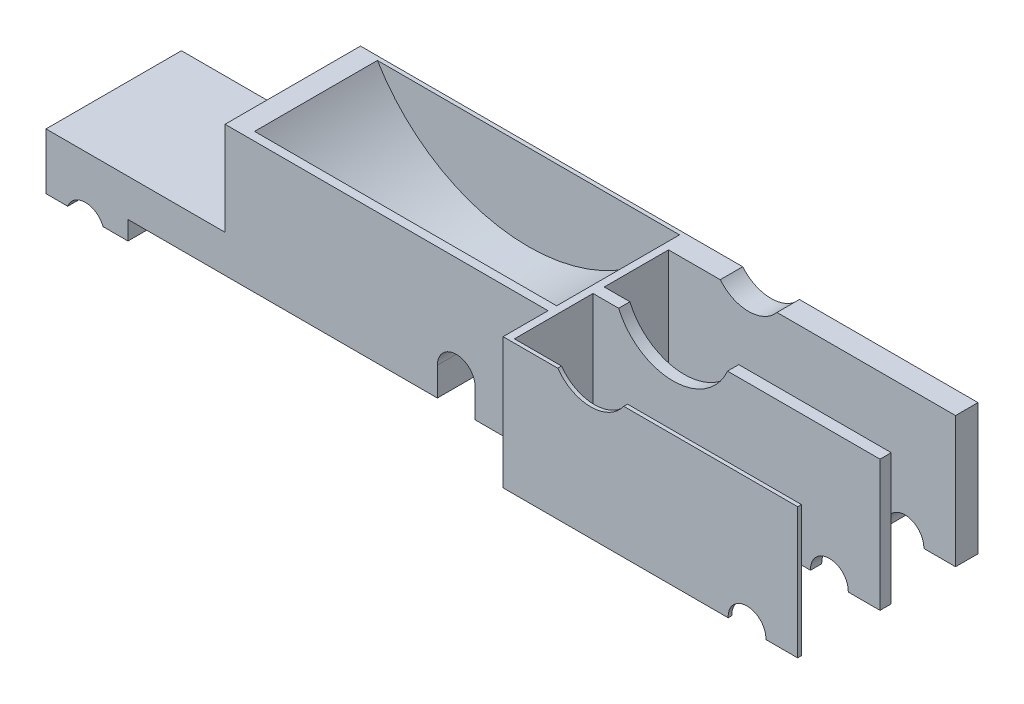
from build123d import *

# Parameters (mm, degrees)
SKETCH1_W           = 419.1
SKETCH1_H           = 142.18412
BOSS_EXTRUDE1_DEPTH = 88.9
SKETCH2_R           = 119.38
CUT_EXTRUDE1_DEPTH  = 83.4009
SKETCH7_W           = 194.780719179
SKETCH7_H           = 43.63974
SKETCH7_H_2         = 53.35016
CUT_EXTRUDE2_DEPTH  = 452.402640644
SKETCH3_R           = 24.99995
CUT_EXTRUDE3_DEPTH  = 15.24
SKETCH4_R           = 40.25011
CUT_EXTRUDE4_DEPTH  = 10
SKETCH5_R           = 27.50058
CUT_EXTRUDE5_DEPTH  = 2.54
SKETCH8_W           = 419.1
SKETCH8_H           = 88.9
CUT_EXTRUDE6_DEPTH  = 7.85114
SKETCH9_W           = 419.1
SKETCH9_H           = 88.9
CUT_EXTRUDE7_DEPTH  = 11.94308
SKETCH10_W          = 219.202
SKETCH10_H          = 88.9
CUT_EXTRUDE8_DEPTH  = 30.48
SKETCH12_W          = 121.533574186
SKETCH12_H          = 91.9099
BOSS_EXTRUDE2_DEPTH = 25.4
SKETCH14_W          = 55.647095764
SKETCH14_H          = 91.9099
BOSS_EXTRUDE3_DEPTH = 12.7
SKETCH17_R          = 12.827
CUT_EXTRUDE10_DEPTH = 446.564033133


with BuildPart() as part:
    # Sketch1 → Boss-Extrude1 (new body)
    with BuildSketch(Plane(origin=(0, 0, 0), x_dir=(1, 0, 0), z_dir=(0, 1, 0))):
        with Locations((209.55, 71.09206)):
            Rectangle(SKETCH1_W, SKETCH1_H)
    extrude(amount=BOSS_EXTRUDE1_DEPTH)

    # Sketch2 → Cut-Extrude1 (cut)
    with BuildSketch(Plane(origin=(0, 0, -131.63296), x_dir=(-1, 0, 0), z_dir=(0, 0, -1))):
        with Locations((-116.7166499, 150.061217688)):
            Circle(SKETCH2_R)
    extrude(amount=-CUT_EXTRUDE1_DEPTH, mode=Mode.SUBTRACT)

    # Sketch7 → Cut-Extrude2 (cut, through all)
    with BuildSketch(Plane(origin=(0, 88.9, 0), x_dir=(1, 0, 0), z_dir=(0, 1, 0))):
        with Locations((321.709640411, 97.27311)):
            Rectangle(SKETCH7_W, SKETCH7_H)
        with Locations((321.709640411, 41.15816)):
            Rectangle(SKETCH7_W, SKETCH7_H_2)
    extrude(amount=-CUT_EXTRUDE2_DEPTH, mode=Mode.SUBTRACT)

    # Sketch3 → Cut-Extrude3 (cut)
    with BuildSketch(Plane(origin=(0, 0, -134.33298), x_dir=(-1, 0, 0), z_dir=(0, 0, -1))):
        with Locations((-278.649352085, 104.852009966)):
            Circle(SKETCH3_R)
    extrude(amount=-CUT_EXTRUDE3_DEPTH, mode=Mode.SUBTRACT)

    # Sketch4 → Cut-Extrude4 (cut)
    with BuildSketch(Plane(origin=(0, 0, -67.83324), x_dir=(-1, 0, 0), z_dir=(0, 0, -1))):
        with Locations((-278.649352085, 104.852009966)):
            Circle(SKETCH4_R)
    extrude(amount=CUT_EXTRUDE4_DEPTH, mode=Mode.SUBTRACT)

    # Sketch5 → Cut-Extrude5 (cut)
    with BuildSketch(Plane(origin=(0, 0, -14.48308), x_dir=(-1, 0, 0), z_dir=(0, 0, -1))):
        with Locations((-278.649352085, 104.852009966)):
            Circle(SKETCH5_R)
    extrude(amount=-CUT_EXTRUDE5_DEPTH, mode=Mode.SUBTRACT)

    # Sketch8 → Cut-Extrude6 (cut)
    with BuildSketch(Plane(origin=(0, 0, -142.18412), x_dir=(-1, 0, 0), z_dir=(0, 0, -1))):
        with Locations((-209.55, 44.45)):
            Rectangle(SKETCH8_W, SKETCH8_H)
    extrude(amount=-CUT_EXTRUDE6_DEPTH, mode=Mode.SUBTRACT)

    # Sketch9 → Cut-Extrude7 (cut)
    with BuildSketch(Plane.XY):
        with Locations((209.55, 44.45)):
            Rectangle(SKETCH9_W, SKETCH9_H)
    extrude(amount=-CUT_EXTRUDE7_DEPTH, mode=Mode.SUBTRACT)

    # Sketch10 → Cut-Extrude8 (cut)
    with BuildSketch(Plane.XY.offset(-11.94308)):
        with Locations((109.601, 44.45)):
            Rectangle(SKETCH10_W, SKETCH10_H)
    extrude(amount=-CUT_EXTRUDE8_DEPTH, mode=Mode.SUBTRACT)

    # Sketch12 → Boss-Extrude2 (add)
    with BuildSketch(Plane.XZ):
        with Locations((-60.766787093, -88.37803)):
            Rectangle(SKETCH12_W, SKETCH12_H)
    extrude(amount=-BOSS_EXTRUDE2_DEPTH)

    # Sketch14 → Boss-Extrude3 (add)
    with BuildSketch(Plane.XZ):
        with Locations((-93.710026304, -88.37803)):
            Rectangle(SKETCH14_W, SKETCH14_H)
    extrude(amount=BOSS_EXTRUDE3_DEPTH)

    # Sketch17 → Cut-Extrude10 (cut, through all)
    with BuildSketch(Plane(origin=(0, 0, -134.33298), x_dir=(-1, 0, 0), z_dir=(0, 0, -1))):
        with Locations((-384.735935495, 0.531880938)):
            Circle(SKETCH17_R)
        with Locations((94.798916194, -17.274045482)):
            Circle(SKETCH17_R)
        with BuildLine():
            Line((-169.736021607, 19.31637742), (-169.736021607, 0))
            Line((-169.736021607, 0), (-144.082021607, 0))
            Line((-144.082021607, 0), (-144.082021607, 19.31637742))
            ThreePointArc((-144.082021607, 19.31637742), (-156.909021607, 32.14337742), (-169.736021607, 19.31637742))
        make_face()
    extrude(amount=-CUT_EXTRUDE10_DEPTH, mode=Mode.SUBTRACT)


solid = part.part
